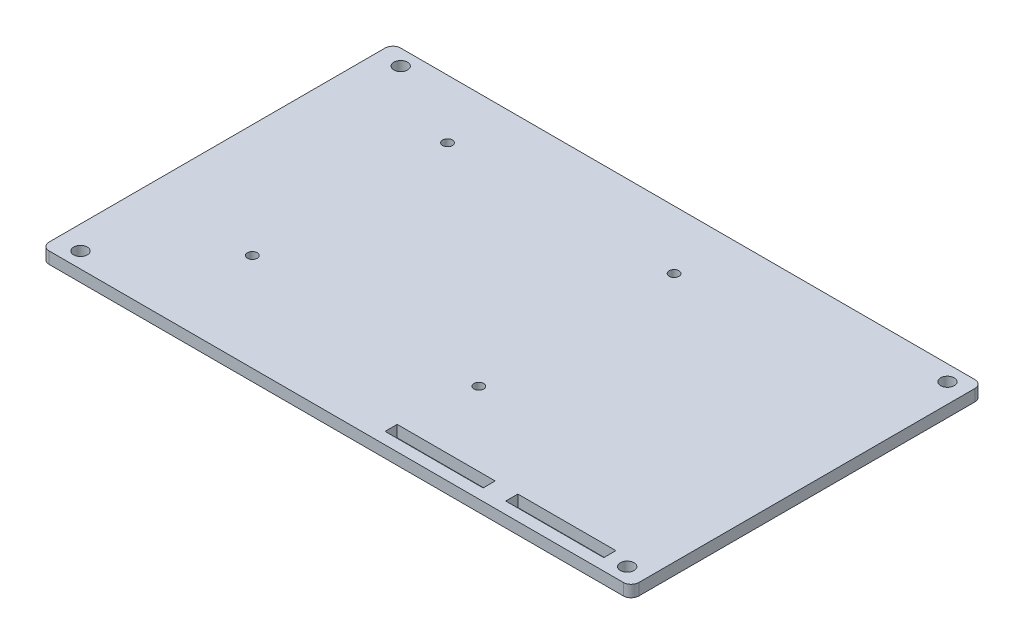
from build123d import *

# Parameters (mm, degrees)
SKETCH1_W               = 151
SKETCH1_H               = 90
BOSS_EXTRUDE1_DEPTH     = 3
SKETCH2_R               = 1.75
CUT_EXTRUDE1_DEPTH      = 176.812400018
FILLET1_R               = 2
SKETCH3_R               = 1.25
CUT_EXTRUDE2_DEPTH      = 176.812400018
CUT_EXTRUDE3_DEPTH      = 176.812400018
CUT_EXTRUDE3_DEPTH_BACK = 176.812400018
SKETCH4_W               = 25.1
SKETCH4_H               = 3.1


with BuildPart() as part:
    # Sketch1 → Boss-Extrude1 (new body)
    with BuildSketch(Plane(origin=(0, 0, 0), x_dir=(1, 0, 0), z_dir=(0, 1, 0))):
        with Locations((75.5, 45)):
            Rectangle(SKETCH1_W, SKETCH1_H)
    extrude(amount=BOSS_EXTRUDE1_DEPTH)

    # Sketch2 → Cut-Extrude1 (cut, through all)
    with BuildSketch(Plane(origin=(0, 3, 0), x_dir=(1, 0, 0), z_dir=(0, 1, 0))):
        with Locations(Location((146, 86, 0), (0, 0, 270))):
            Circle(SKETCH2_R)
        with Locations(Location((146, 4, 0), (0, 0, 270))):
            Circle(SKETCH2_R)
        with Locations(Location((6, 86, 0), (0, 0, 270))):
            Circle(SKETCH2_R)
        with Locations(Location((6, 4, 0), (0, 0, 270))):
            Circle(SKETCH2_R)
    extrude(amount=-CUT_EXTRUDE1_DEPTH, mode=Mode.SUBTRACT)

    # Fillet1
    fillet1_edges = [part.edges().sort_by_distance(p)[0] for p in [
        (0, 1.5, -90),
        (151, 1.5, -90),
        (151, 1.5, 0),
        (0, 1.5, 0),
    ]]
    fillet(fillet1_edges, radius=FILLET1_R)

    # Sketch3 → Cut-Extrude2 (cut, through all)
    with BuildSketch(Plane(origin=(0, 3, 0), x_dir=(1, 0, 0), z_dir=(0, 1, 0))):
        with Locations(Location((87, 75, 0), (0, 0, 270))):
            Circle(SKETCH3_R)
        with Locations(Location((29, 75, 0), (0, 0, 270))):
            Circle(SKETCH3_R)
        with Locations(Location((87, 25, 0), (0, 0, 270))):
            Circle(SKETCH3_R)
        with Locations(Location((29, 25, 0), (0, 0, 270))):
            Circle(SKETCH3_R)
    extrude(amount=-CUT_EXTRUDE2_DEPTH, mode=Mode.SUBTRACT)

    # Sketch4 → Cut-Extrude3 (cut, two sides: drawn at the far end of the back side and taken through both)
    with BuildSketch(Plane(origin=(0, 3, 0), x_dir=(1, 0, 0), z_dir=(0, 1, 0)).offset(-CUT_EXTRUDE3_DEPTH_BACK)):
        with Locations((97.55, 4.55)):
            Rectangle(SKETCH4_W, SKETCH4_H)
        with Locations((128.45, 4.55)):
            Rectangle(SKETCH4_W, SKETCH4_H)
    extrude(amount=CUT_EXTRUDE3_DEPTH + CUT_EXTRUDE3_DEPTH_BACK, mode=Mode.SUBTRACT)


solid = part.part
